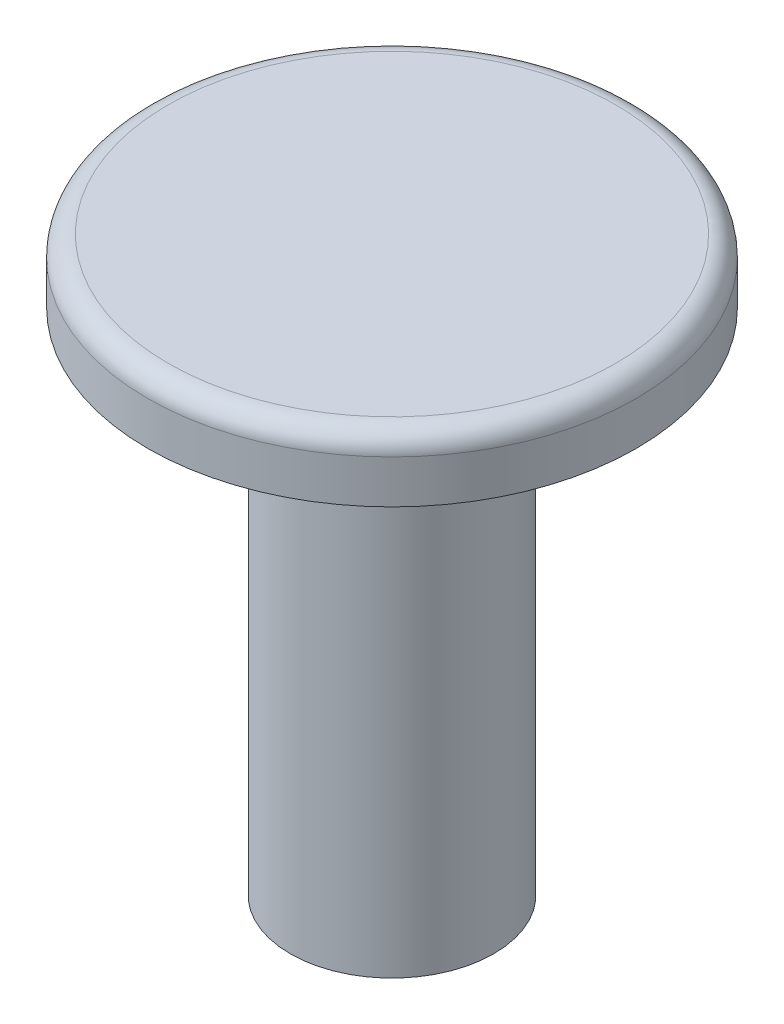
from build123d import *

# Parameters (mm, degrees)
SKETCH1_R           = 2
BOSS_EXTRUDE1_DEPTH = 10
SKETCH2_R           = 4.8
BOSS_EXTRUDE2_DEPTH = 1.25
FILLET2_R           = 0.4


with BuildPart() as part:
    # Sketch1 → Boss-Extrude1 (new body)
    with BuildSketch(Plane(origin=(0, 0, 0), x_dir=(1, 0, 0), z_dir=(0, 1, 0))):
        Circle(SKETCH1_R)
    extrude(amount=BOSS_EXTRUDE1_DEPTH)

    # Sketch2 → Boss-Extrude2 (add)
    with BuildSketch(Plane(origin=(0, 10, 0), x_dir=(1, 0, 0), z_dir=(0, 1, 0))):
        Circle(SKETCH2_R)
    extrude(amount=BOSS_EXTRUDE2_DEPTH)

    # Fillet2
    fillet2_edges = [part.edges().sort_by_distance(p)[0] for p in [
        (-4.8, 11.25, 0),
    ]]
    fillet(fillet2_edges, radius=FILLET2_R)


solid = part.part
